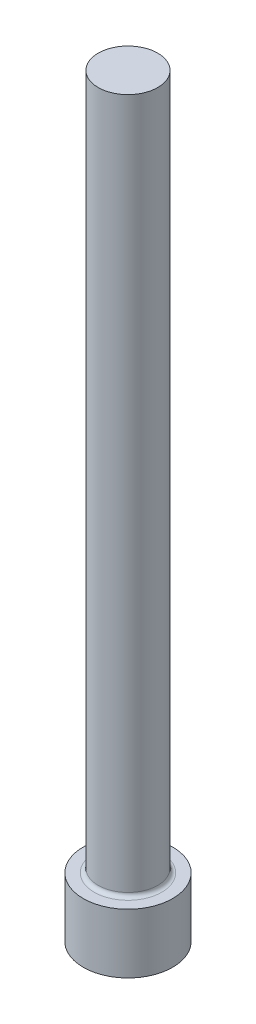
from build123d import *

# Parameters (mm, degrees)
FILLET_1_R          = 0.2
CUT_EXTRUDE_1_DEPTH = 1.5


with BuildPart() as part:
    # 草图1 → 旋转1 (revolve)
    with BuildSketch(Plane(origin=(0, 0, 0), x_dir=(0, 0, -1), z_dir=(1, 0, 0))):
        Polygon((0, 0), (-2.25, 0), (-2.25, 3), (-1.5, 3), (-1.5, 38), (0, 38), align=None)
    revolve(axis=Axis((0, 38, 0), (0, -1, 0)))

    # 圆角1
    fillet_1_edges = [part.edges().sort_by_distance(p)[0] for p in [
        (0, 3, -1.5),
    ]]
    fillet(fillet_1_edges, radius=FILLET_1_R)

    # 草图2 → 切除-拉伸1 (cut)
    with BuildSketch(Plane.XZ):
        Polygon((0, 1.35099963), (-1.17, 0.675499815), (-1.17, -0.675499815), (0, -1.35099963), (1.17, -0.675499815), (1.17, 0.675499815), align=None)
    extrude(amount=-CUT_EXTRUDE_1_DEPTH, mode=Mode.SUBTRACT)


solid = part.part
